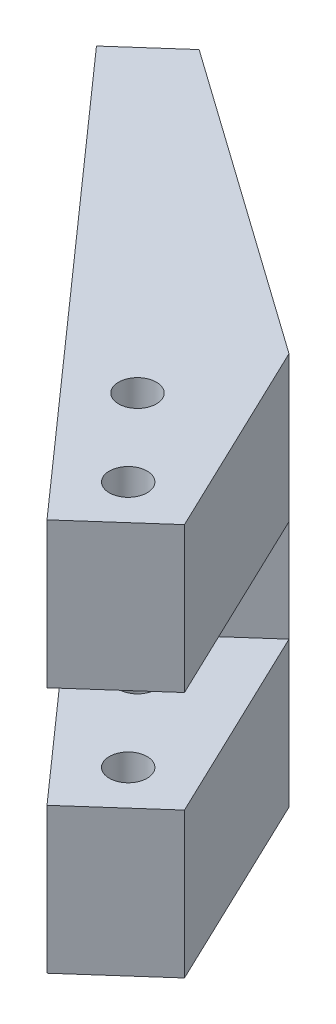
from build123d import *

# Parameters (mm, degrees)
BOSS_EXTRUDE1_DEPTH      = 14
SKETCH3_R                = 4.125
CUT_EXTRUDE1_DEPTH       = 6
SKETCH5_R                = 1.125
CUT_EXTRUDE2_DEPTH       = 15
FILLET1_R                = 1
BOSS_EXTRUDE3_DEPTH      = 20
BOSS_EXTRUDE3_DEPTH_BACK = 34
SKETCH7_W                = 46.707438453
SKETCH7_H                = 20
CUT_EXTRUDE3_DEPTH       = 30
BOSS_EXTRUDE4_DEPTH      = 3
BOSS_EXTRUDE5_START      = -54
BOSS_EXTRUDE5_DEPTH      = 3
CUT_EXTRUDE5_REACH       = 111.564
SKETCH15_W               = 26.880557743
SKETCH15_H               = 40.856784115
CUT_EXTRUDE6_REACH       = 113.249
SKETCH16_R               = 1.6
CUT_EXTRUDE7_DEPTH       = 108.082055537
CUT_EXTRUDE7_DEPTH_BACK  = 108.082055537
SKETCH19_W               = 109.652108874
SKETCH19_H               = 14
SKETCH21_W               = 96.727229551
SKETCH21_H               = 14
CUT_EXTRUDE8_DEPTH       = 79.38857666
SKETCH22_R               = 2.6
CUT_EXTRUDE9_DEPTH       = 83.047416404


with BuildPart() as part:
    # Sketch1 → Boss-Extrude1 (new body)
    with BuildSketch(Plane(origin=(0, 0, 0), x_dir=(1, 0, 0), z_dir=(0, 1, 0))):
        with BuildLine():
            Line((47.5, -78.442713945), (47.5, -38.442713945))
            ThreePointArc((47.5, -38.442713945), (23.122023742, 0), (47.5, 38.442713945))
            Line((47.5, 38.442713945), (47.5, 50))
            Line((47.5, 50), (42.5, 50))
            Line((42.5, 50), (0, 0))
            Line((0, 0), (35.1, -73.422380253))
            Line((35.1, -73.422380253), (35.1, -93.442713945))
            Line((35.1, -93.442713945), (37.5, -93.442713945))
            Line((37.5, -93.442713945), (47.5, -93.442713945))
            Line((47.5, -93.442713945), (47.5, -78.442713945))
        make_face()
    extrude(amount=BOSS_EXTRUDE1_DEPTH)

    # Sketch3 → Cut-Extrude1 (cut)
    with BuildSketch(Plane.XZ):
        with BuildLine():
            Line((33.254958794, 84.403112572), (36.18509612, 92.428977457))
            Line((36.18509612, 92.428977457), (44.88509612, 92.428977457))
            Line((44.88509612, 92.428977457), (46.13509612, 88.028977457))
            Line((46.13509612, 88.028977457), (46.13509612, 70.028977457))
            Line((46.13509612, 70.028977457), (44.820911197, 53.062159312))
            ThreePointArc((44.820911197, 53.062159312), (40.059955227, 48.679043991), (35.34566343, 53.112310791))
            Line((35.34566343, 53.112310791), (33.254958794, 84.403112572))
        make_face()
        with Locations(Location((40.08509612, 83.428977457, 0), (0, 0, 90))):
            Circle(SKETCH3_R, mode=Mode.SUBTRACT)
    extrude(amount=-CUT_EXTRUDE1_DEPTH, mode=Mode.SUBTRACT)

    # Sketch5 → Cut-Extrude2 (cut)
    with BuildSketch(Plane.XZ.offset(-6)):
        with Locations(Location((40.08509612, 63.428977457, 0), (0, 0, 270))):
            Circle(SKETCH5_R)
        with Locations(Location((40.08509612, 58.928977457, 0), (0, 0, 270))):
            Circle(SKETCH5_R)
        with Locations(Location((40.08509612, 53.428977457, 0), (0, 0, 270))):
            Circle(SKETCH5_R)
    extrude(amount=-CUT_EXTRUDE2_DEPTH, mode=Mode.SUBTRACT)

    # Fillet1
    fillet1_edges = [part.edges().sort_by_distance(p)[0] for p in [
        (21.25, 0, -25),
        (45, 0, -50),
        (47.5, 0, -44.221356973),
        (23.122023742, 14, 0),
        (23.122023742, 0, 0),
        (47.5, 0, 65.942713945),
        (47.5, 14, -44.221356973),
        (42.5, 7, -50),
        (47.5, 7, -50),
        (47.5, 7, -38.442713945),
        (47.5, 7, 38.442713945),
        (45, 14, -50),
        (21.25, 14, -25),
        (47.5, 14, 65.942713945),
    ]]
    fillet(fillet1_edges, radius=FILLET1_R)

    # Sketch6 → Boss-Extrude3 (add, two sides: drawn at the far end of the back side and taken through both)
    with BuildSketch(Plane.XZ.offset(-BOSS_EXTRUDE3_DEPTH_BACK)):
        with BuildLine():
            Line((-40.458581161, -20.077158004), (-49.887563088, -23.407968691))
            Line((-49.887563088, -23.407968691), (34.124921356, 71.382705183))
            Line((34.124921356, 71.382705183), (0, 0))
            ThreePointArc((0, 0), (-10.212270894, 1.77453397), (-20.560220827, 2.374016932))
            Line((-20.560220827, 2.374016932), (-40.458581161, -20.077158004))
        make_face()
    extrude(amount=BOSS_EXTRUDE3_DEPTH + BOSS_EXTRUDE3_DEPTH_BACK)

    # Sketch7 → Cut-Extrude3 (cut)
    with BuildSketch(Plane(origin=(-16.32086192, 0, 14.465095586), x_dir=(0.6632786778078259, 0, 0.7483724978682089), z_dir=(-0.7483724978682089, 0, 0.6632786778078259))):
        with Locations((52.701466874, 24)):
            Rectangle(SKETCH7_W, SKETCH7_H)
        with Locations((52.701466874, -10)):
            Rectangle(SKETCH7_W, SKETCH7_H)
    extrude(amount=-CUT_EXTRUDE3_DEPTH, mode=Mode.SUBTRACT)

    # Sketch10 → Boss-Extrude4 (add)
    with BuildSketch(Plane.XZ.offset(20)):
        Polygon((-49.887563088, -23.407968691), (-42.403838109, -30.040755469), (0, 0), (-16.723629197, 14.010656202), align=None)
    extrude(amount=-BOSS_EXTRUDE4_DEPTH)

    # Sketch10<2> → Boss-Extrude5 (add)
    with BuildSketch(Plane.XZ.offset(20).offset(BOSS_EXTRUDE5_START)):
        Polygon((-49.887563088, -23.407968691), (-42.403838109, -30.040755469), (0, 0), (-16.723629197, 14.010656202), align=None)
    extrude(amount=BOSS_EXTRUDE5_DEPTH)

    # Cut-Extrude5: up to this face of the body (flat: up to its plane)
    cut_extrude5_end = Plane(part.part.faces().sort_by_distance((40.08509612, 0, 83.428977457))[0])
    # Sketch15 → Cut-Extrude5 (cut, up to the picked face)
    with BuildSketch(Plane(origin=(0, 6, 0), x_dir=(-1, 0, 0), z_dir=(0, -1, 0)), mode=Mode.PRIVATE) as cut_extrude5_sk1:
        with Locations((-44.420319758, -91.811097241)):
            Rectangle(SKETCH15_W, SKETCH15_H)
    cut_extrude5_tool1 = split(extrude(cut_extrude5_sk1.sketch, amount=CUT_EXTRUDE5_REACH, mode=Mode.PRIVATE), bisect_by=cut_extrude5_end, keep=Keep.BOTH, mode=Mode.PRIVATE)
    add(cut_extrude5_tool1.solids().sort_by(Axis((44.42032, 6, 91.811097), (0, -1, 0)))[0], mode=Mode.SUBTRACT)

    # Sketch16 → Cut-Extrude6 (cut, up to next)
    with BuildSketch(Plane(origin=(0, 14, 0), x_dir=(1, 0, 0), z_dir=(0, 1, 0)), mode=Mode.PRIVATE) as cut_extrude6_sk1:
        with Locations(Location((40.08509612, -83.428977457, 0), (0, 0, 270))):
            Circle(SKETCH16_R)
    cut_extrude6_tool1 = extrude(cut_extrude6_sk1.sketch, amount=-CUT_EXTRUDE6_REACH, mode=Mode.PRIVATE) & part.part
    add(cut_extrude6_tool1.solids().sort_by_distance((40.085096, 14, 83.428977))[0], mode=Mode.SUBTRACT)

    # Sketch19 → Cut-Extrude7 (cut, two sides: drawn at the far end of the back side and taken through both)
    with BuildSketch(Plane(origin=(-16.32086192, 0, 14.465095586), x_dir=(0.6632786778078262, 0, 0.7483724978682087), z_dir=(-0.7483724978682087, 0, 0.6632786778078262)).offset(-CUT_EXTRUDE7_DEPTH_BACK)):
        with Locations((54.826054437, 7)):
            Rectangle(SKETCH19_W, SKETCH19_H)
    extrude(amount=CUT_EXTRUDE7_DEPTH + CUT_EXTRUDE7_DEPTH_BACK, mode=Mode.SUBTRACT)


with BuildPart() as cut_extrude7_piece_1:
    # of the separate pieces the step leaves, piece 1, a body of its own (cut_extrude7_pieces)
    add(part.part.solids().sort_by_distance((3.144873335, 0, 36.428142799))[0])

    # Sketch22 → Cut-Extrude9 (cut, through all)
    with BuildSketch(Plane(origin=(0, -20, 0), x_dir=(-1, 0, 0), z_dir=(0, -1, 0))):
        with Locations(Location((5.733478103, -15.103299236, 0), (0, 0, 90))):
            Circle(SKETCH22_R)
        with Locations(Location((-4.215702064, -26.328886704, 0), (0, 0, 90))):
            Circle(SKETCH22_R)
    extrude(amount=-CUT_EXTRUDE9_DEPTH, mode=Mode.SUBTRACT)


with BuildPart() as cut_extrude7_piece_2:
    # of the separate pieces the step leaves, piece 2, a body of its own (cut_extrude7_pieces)
    add(part.part.solids().sort_by_distance((46.5, 0, -41.212709721))[0])

    # Sketch21 → Cut-Extrude8 (cut, through all)
    with BuildSketch(Plane(origin=(0, 0, 0), x_dir=(-0.4313049702307203, 0, -0.902206197415135), z_dir=(0.902206197415135, 0, -0.4313049702307203))):
        with Locations((24.708571423, 7)):
            Rectangle(SKETCH21_W, SKETCH21_H)
    extrude(amount=CUT_EXTRUDE8_DEPTH, mode=Mode.SUBTRACT)


solid = cut_extrude7_piece_1.part
